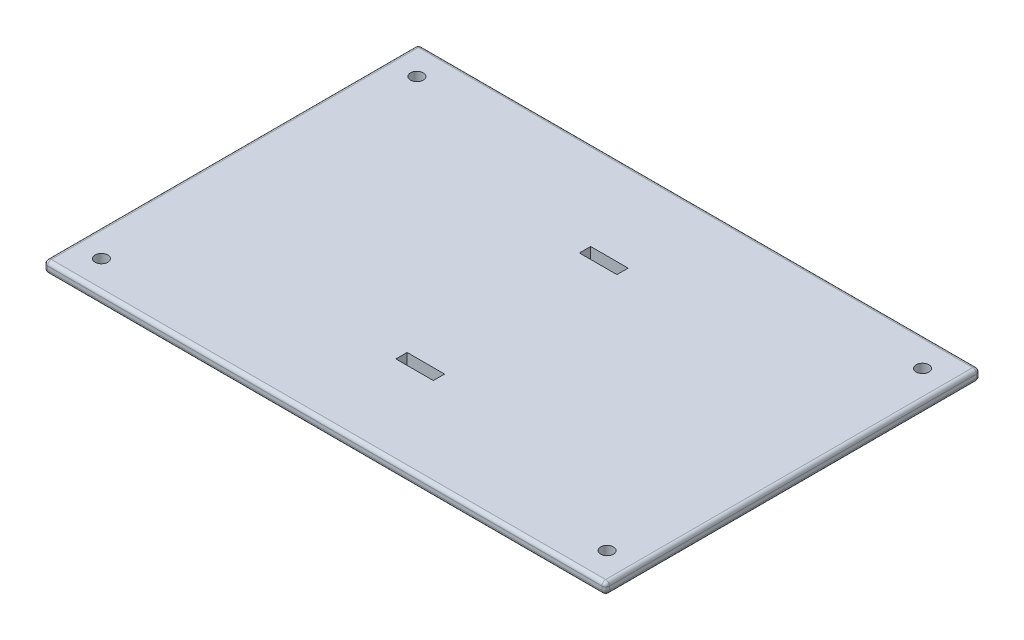
from build123d import *

# Parameters (mm, degrees)
ESQUISSE1_W             = 150
ESQUISSE1_H             = 100
BOSS_EXTRU_1_DEPTH      = 3
CONG_1_R                = 1
D_GAGEMENT_M31_D        = 3.4
D_GAGEMENT_M31_DEPTH    = 5
D_GAGEMENT_M31_TIP      = 1.021463052
ESQUISSE4_W             = 10
ESQUISSE4_H             = 3
ENL_V_MAT_EXTRU_1_DEPTH = 3


with BuildPart() as part:
    # Esquisse1 → Boss.-Extru.1 (new body)
    with BuildSketch(Plane(origin=(0, 0, 0), x_dir=(1, 0, 0), z_dir=(0, 1, 0))):
        Rectangle(ESQUISSE1_W, ESQUISSE1_H)
    extrude(amount=BOSS_EXTRU_1_DEPTH)

    # Congé1
    cong_1_edges = [part.edges().sort_by_distance(p)[0] for p in [
        (-75, 3, 0),
        (0, 3, 50),
        (75, 3, 0),
        (0, 0, 50),
        (-75, 0, 0),
        (0, 0, -50),
        (75, 0, 0),
        (0, 3, -50),
        (75, 1.5, 50),
        (-75, 1.5, 50),
        (-75, 1.5, -50),
        (75, 1.5, -50),
    ]]
    fillet(cong_1_edges, radius=CONG_1_R)

    # Dégagement M31
    with Locations(Plane(origin=(0, 3, 0), x_dir=(-1, 0, 0), z_dir=(0, 1, 0))):
        with Locations((67.5, 42.113248654), (-67.5, 42.113248654), (-67.5, -42.113248654), (67.5, -42.113248654)):
            Hole(D_GAGEMENT_M31_D / 2, depth=D_GAGEMENT_M31_DEPTH)
            with Locations((0, 0, -(D_GAGEMENT_M31_DEPTH + D_GAGEMENT_M31_TIP / 2))):  # 118° drill point
                Cone(0, D_GAGEMENT_M31_D / 2, D_GAGEMENT_M31_TIP, mode=Mode.SUBTRACT)

    # Esquisse4 → Enlèv. mat.-Extru.1 (cut)
    with BuildSketch(Plane(origin=(0, 3, 0), x_dir=(1, 0, 0), z_dir=(0, 1, 0))):
        with Locations((0, 24.5)):
            Rectangle(ESQUISSE4_W, ESQUISSE4_H)
        with Locations((0, -24.5)):
            Rectangle(ESQUISSE4_W, ESQUISSE4_H)
    extrude(amount=-ENL_V_MAT_EXTRU_1_DEPTH, mode=Mode.SUBTRACT)


solid = part.part
